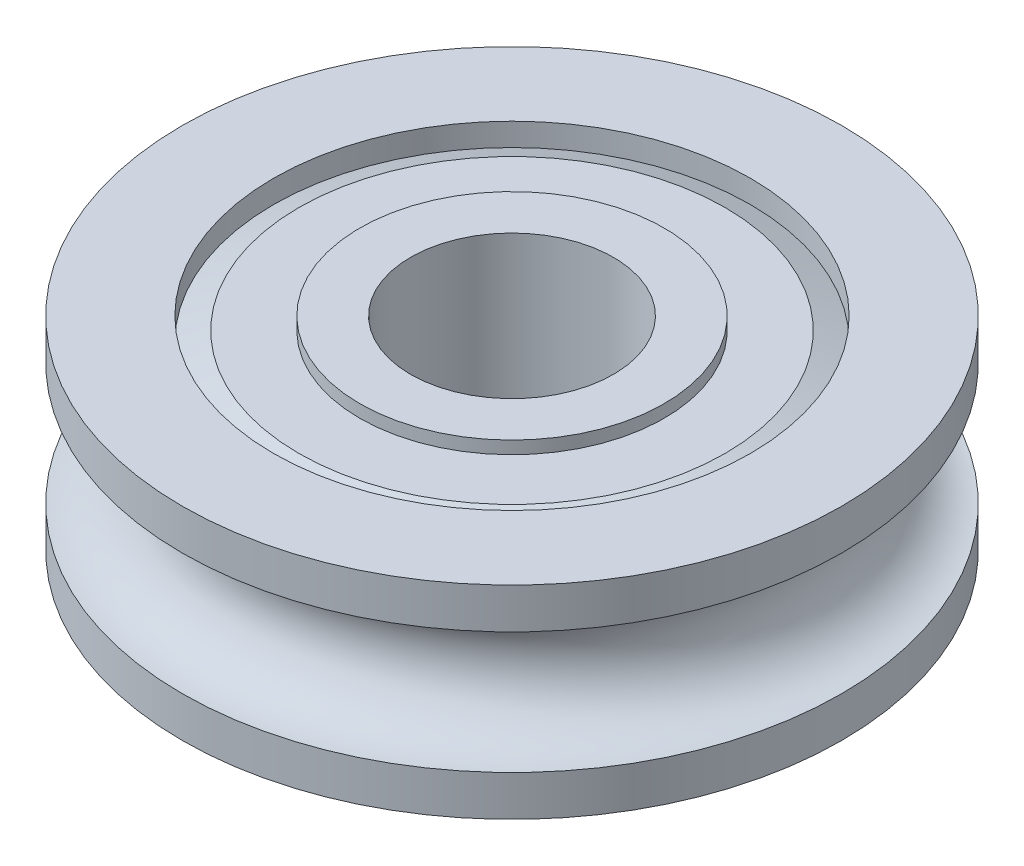
from build123d import *

# Parameters (mm, degrees)
SKETCH2_R          = 2
CUT_EXTRUDE1_DEPTH = 11.024968828
SKETCH3_R          = 4.7
SKETCH3_R_2        = 3
CUT_EXTRUDE2_DEPTH = 0.25


with BuildPart() as part:
    # Sketch1 → Revolve1 (revolve)
    with BuildSketch(Plane.XY, mode=Mode.PRIVATE) as revolve1_sk:
        with BuildLine():
            Line((0, 2), (0, -2))
            Line((0, -2), (6.5, -2))
            Line((6.5, -2), (6.5, -1.2))
            ThreePointArc((6.5, -1.2), (5.3, 0), (6.5, 1.2))
            Line((6.5, 1.2), (6.5, 2))
            Line((6.5, 2), (0, 2))
        make_face()
    revolve(revolve1_sk.sketch.rotate(Axis((0, 2, 0), (0, -1, 0)), 90), axis=Axis((0, 2, 0), (0, -1, 0)))

    # Sketch2 → Cut-Extrude1 (cut, through all)
    with BuildSketch(Plane(origin=(0, 2, 0), x_dir=(1, 0, 0), z_dir=(0, 1, 0))):
        with Locations(Location((0, 0, 0), (0, 0, 270))):
            Circle(SKETCH2_R)
    extrude(amount=-CUT_EXTRUDE1_DEPTH, mode=Mode.SUBTRACT)

    # Sketch3 → Cut-Extrude2 (cut)
    with BuildSketch(Plane(origin=(0, 2, 0), x_dir=(1, 0, 0), z_dir=(0, 1, 0))):
        with Locations(Location((0, 0, 0), (0, 0, 270))):
            Circle(SKETCH3_R)
        with Locations(Location((0, 0, 0), (0, 0, 270))):
            Circle(SKETCH3_R_2, mode=Mode.SUBTRACT)
    cut_extrude2 = extrude(amount=-CUT_EXTRUDE2_DEPTH, mode=Mode.SUBTRACT)

    # Sketch4 → Cut-Revolve1 (revolve, cut)
    with BuildSketch(Plane.XY, mode=Mode.PRIVATE) as cut_revolve1_sk:
        Polygon((4.7, 1.75), (4.2, 1.75), (4.7, 1.55), align=None)
    cut_revolve1 = revolve(cut_revolve1_sk.sketch.rotate(Axis((0, 1.75, 0), (0, 1, 0)), 270), axis=Axis((0, 1.75, 0), (0, 1, 0)), mode=Mode.SUBTRACT)

    # Mirror1: Cut-Extrude2, Cut-Revolve1 across plane
    add(cut_extrude2.mirror(Plane.ZX), mode=Mode.SUBTRACT)
    add(cut_revolve1.mirror(Plane.ZX), mode=Mode.SUBTRACT)


solid = part.part
